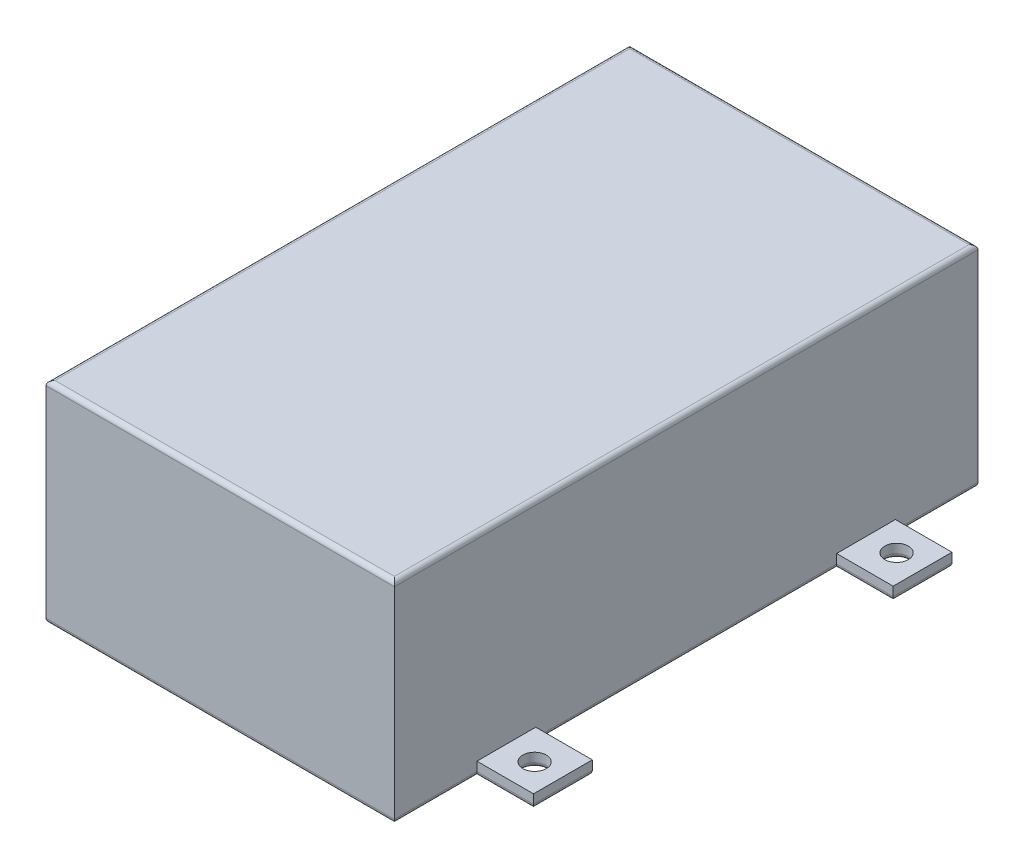
from build123d import *

# Parameters (mm, degrees)
SKETCH_1_W          = 77
SKETCH_1_H          = 129
EXTRUDE_1_DEPTH     = 46.5
SKETCH_2_W          = 12.5
SKETCH_2_H          = 13
SKETCH_2_R          = 2.6
EXTRUDE_2_DEPTH     = 3
SKETCH_3_R          = 4
CUT_EXTRUDE_1_DEPTH = 5
FILLET_1_R          = 1


with BuildPart() as part:
    # 草图1 → 凸台-拉伸1 (new body)
    with BuildSketch(Plane(origin=(0, 0, 0), x_dir=(1, 0, 0), z_dir=(0, 1, 0))):
        Rectangle(SKETCH_1_W, SKETCH_1_H)
    extrude(amount=EXTRUDE_1_DEPTH)

    # 草图2 → 凸台-拉伸2 (add)
    # profile 1 of 4: a face of its own
    with BuildSketch(Plane.XZ):
        with Locations((-44.75, 39.75)):
            Rectangle(SKETCH_2_W, SKETCH_2_H)
        with Locations(Location((-45, 40, 0), (0, 0, 270))):
            Circle(SKETCH_2_R, mode=Mode.SUBTRACT)
    # profile 2 of 4: a face of its own
    with BuildSketch(Plane.XZ):
        with Locations((44.75, 39.75)):
            Rectangle(SKETCH_2_W, SKETCH_2_H)
        with Locations(Location((45, 40, 0), (0, 0, 90))):
            Circle(SKETCH_2_R, mode=Mode.SUBTRACT)
    # profile 3 of 4: a face of its own
    with BuildSketch(Plane.XZ):
        with Locations((44.75, -39.75)):
            Rectangle(SKETCH_2_W, SKETCH_2_H)
        with Locations(Location((45, -40, 0), (0, 0, 270))):
            Circle(SKETCH_2_R, mode=Mode.SUBTRACT)
    # profile 4 of 4: a face of its own
    with BuildSketch(Plane.XZ):
        with Locations((-44.75, -39.75)):
            Rectangle(SKETCH_2_W, SKETCH_2_H)
        with Locations(Location((-45, -40, 0), (0, 0, 90))):
            Circle(SKETCH_2_R, mode=Mode.SUBTRACT)
    extrude(amount=-EXTRUDE_2_DEPTH)

    # 草图3 → 切除-拉伸1 (cut)
    with BuildSketch(Plane(origin=(0, 0, -64.5), x_dir=(-1, 0, 0), z_dir=(0, 0, -1))):
        with Locations((25, 23.25)):
            Circle(SKETCH_3_R)
    extrude(amount=-CUT_EXTRUDE_1_DEPTH, mode=Mode.SUBTRACT)

    # 圆角1
    fillet_1_edges = [part.edges().sort_by_distance(p)[0] for p in [
        (-38.5, 46.5, 0),
        (-38.5, 0, 55.375),
        (0, 46.5, 64.5),
        (-44.75, 0, 46.25),
        (-51, 0, 39.75),
        (-44.75, 0, 33.25),
        (-45, 0, 42.6),
        (38.5, 0, 0),
        (44.75, 0, 33.25),
        (51, 0, 39.75),
        (44.75, 0, 46.25),
        (45, 0, 37.4),
        (38.5, 0, -55.375),
        (44.75, 0, -46.25),
        (51, 0, -39.75),
        (44.75, 0, -33.25),
        (45, 0, -37.4),
        (38.5, 46.5, 0),
        (0, 0, 64.5),
        (-38.5, 0, 0),
        (-38.5, 0, -55.375),
        (-44.75, 0, -33.25),
        (-51, 0, -39.75),
        (-44.75, 0, -46.25),
        (-45, 0, -42.6),
        (0, 0, -64.5),
        (38.5, 0, 55.375),
        (0, 46.5, -64.5),
    ]]
    fillet(fillet_1_edges, radius=FILLET_1_R)


solid = part.part
